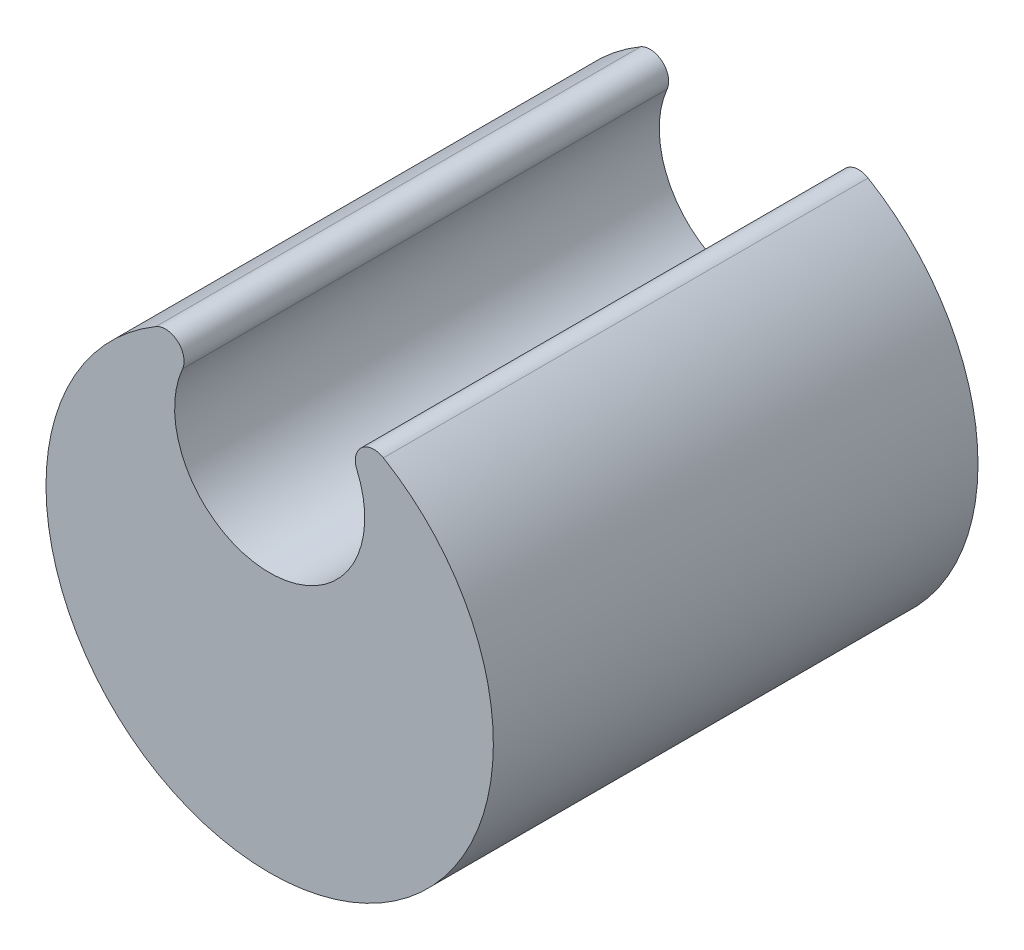
from build123d import *

# Parameters (mm, degrees)
AUFSATZ_LINEAR_AUSTRAGEN2_DEPTH = 13
VERRUNDUNG1_R                   = 0.5


with BuildPart() as part:
    # Skizze1 → Aufsatz-Linear austragen2 (new body)
    with BuildSketch(Plane.XY):
        with BuildLine():
            ThreePointArc((-0.771783993, 5.950155415), (-3.960384832, -4.507255482), (6, 0))
            ThreePointArc((6, 0), (4.507255482, 3.960384832), (0.771783993, 5.950155415))
            ThreePointArc((0.771783993, 5.950155415), (2.057978278, 5.025485179), (2.55, 3.519754323))
            ThreePointArc((2.55, 3.519754323), (-1.505730855, 1.461776046), (-0.771783993, 5.950155415))
        make_face()
    extrude(amount=AUFSATZ_LINEAR_AUSTRAGEN2_DEPTH)

    # Verrundung1
    verrundung1_edges = [part.edges().sort_by_distance(p)[0] for p in [
        (-0.771783993, 5.950155415, 6.5),
        (0.771783993, 5.950155415, 6.5),
    ]]
    fillet(verrundung1_edges, radius=VERRUNDUNG1_R)


solid = part.part
